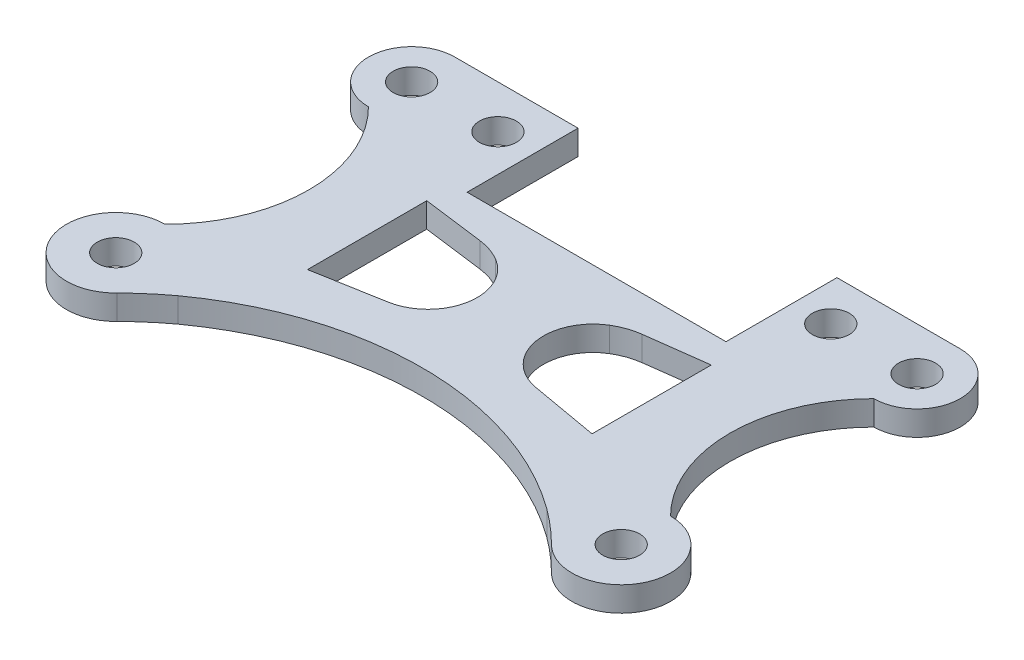
from build123d import *

# Parameters (mm, degrees)
SKETCH1_R             = 1.5
BOSS_EXTRUDE1_DEPTH   = 2
SKETCH2_R             = 3.5
BOSS_EXTRUDE2_DEPTH   = 2
SKETCH3_R             = 1.5
CUT_EXTRUDE1_DEPTH    = 2
SKETCH4_R             = 1.5
CUT_EXTRUDE2_DEPTH    = 2
BOSS_EXTRUDE3_START   = -2
BOSS_EXTRUDE3_DEPTH   = 2
SKETCH8_R             = 4
BOSS_EXTRUDE5_DEPTH   = 2
SKETCH9_R             = 1.5
CUT_EXTRUDE4_DEPTH    = 2
CUT_EXTRUDE5_DEPTH    = 2
BOSS_EXTRUDE12_DEPTH  = 2
CUT_EXTRUDE11_DEPTH   = 2
CUT_EXTRUDE15_DEPTH   = 19
FILLET1_R             = 5
FILLET2_R             = 4
FILLET1_OF_MIRROR13_R = 5
FILLET2_OF_MIRROR13_R = 4


with BuildPart() as part:
    # Sketch1 → Boss-Extrude1 (new body)
    # profile 1 of 5: a face of its own
    with BuildSketch(Plane(origin=(0, 0, 0), x_dir=(1, 0, 0), z_dir=(0, 1, 0))):
        with BuildLine():
            Line((20.5, 14), (10.5, 14))
            Line((10.5, 14), (10.5, 5))
            Line((10.5, 5), (-10.5, 5))
            Line((-10.5, 5), (-10.5, 14))
            Line((-10.5, 14), (-20.5, 14))
            Line((-20.5, 14), (-20.5, -14))
            ThreePointArc((-20.5, -14), (0, -5.789884137), (20.5, -14))
            Line((20.5, -14), (20.5, 7))
            ThreePointArc((20.5, 7), (17, 10.5), (20.5, 14))
        make_face()
        with Locations(Location((13.5, 10.5, 0), (0, 0, 270))):
            Circle(SKETCH1_R, mode=Mode.SUBTRACT)
    # profile 2 of 5: a face of its own
    with BuildSketch(Plane(origin=(0, 0, 0), x_dir=(1, 0, 0), z_dir=(0, 1, 0))):
        with BuildLine():
            ThreePointArc((24, 10.5), (22.974873734, 12.974873734), (20.5, 14))
            Line((20.5, 14), (20.5, 12))
            ThreePointArc((20.5, 12), (21.560660172, 11.560660172), (22, 10.5))
            ThreePointArc((22, 10.5), (21.560660172, 9.439339828), (20.5, 9))
            Line((20.5, 9), (20.5, 7))
            ThreePointArc((20.5, 7), (22.974873734, 8.025126266), (24, 10.5))
        make_face()
    # profile 3 of 5: a face of its own
    with BuildSketch(Plane(origin=(0, 0, 0), x_dir=(1, 0, 0), z_dir=(0, 1, 0))):
        with BuildLine():
            Line((20.5, 12), (20.5, 14))
            ThreePointArc((20.5, 14), (17, 10.5), (20.5, 7))
            Line((20.5, 7), (20.5, 9))
            ThreePointArc((20.5, 9), (19, 10.5), (20.5, 12))
        make_face()
    # profile 4 of 5: a face of its own
    with BuildSketch(Plane(origin=(0, 0, 0), x_dir=(1, 0, 0), z_dir=(0, 1, 0))):
        with BuildLine():
            ThreePointArc((24, 10.5), (22.974873734, 12.974873734), (20.5, 14))
            Line((20.5, 14), (20.5, 12))
            ThreePointArc((20.5, 12), (21.560660172, 11.560660172), (22, 10.5))
            ThreePointArc((22, 10.5), (21.560660172, 9.439339828), (20.5, 9))
            Line((20.5, 9), (20.5, 7))
            ThreePointArc((20.5, 7), (22.974873734, 8.025126266), (24, 10.5))
        make_face()
    # profile 5 of 5: a face of its own
    with BuildSketch(Plane(origin=(0, 0, 0), x_dir=(1, 0, 0), z_dir=(0, 1, 0))):
        with BuildLine():
            Line((20.5, 12), (20.5, 14))
            ThreePointArc((20.5, 14), (17, 10.5), (20.5, 7))
            Line((20.5, 7), (20.5, 9))
            ThreePointArc((20.5, 9), (19, 10.5), (20.5, 12))
        make_face()
    extrude(amount=BOSS_EXTRUDE1_DEPTH)

    # Sketch2 → Boss-Extrude2 (add)
    with BuildSketch(Plane(origin=(0, 2, 0), x_dir=(1, 0, 0), z_dir=(0, 1, 0))):
        with Locations((-20.5, 10.5)):
            Circle(SKETCH2_R)
    extrude(amount=-BOSS_EXTRUDE2_DEPTH)

    # Sketch3 → Cut-Extrude1 (cut)
    with BuildSketch(Plane(origin=(0, 2, 0), x_dir=(1, 0, 0), z_dir=(0, 1, 0))):
        with Locations(Location((-20.5, 10.5, 0), (0, 0, 270))):
            Circle(SKETCH3_R)
    extrude(amount=-CUT_EXTRUDE1_DEPTH, mode=Mode.SUBTRACT)

    # Sketch4 → Cut-Extrude2 (cut)
    with BuildSketch(Plane(origin=(0, 2, 0), x_dir=(1, 0, 0), z_dir=(0, 1, 0))):
        with Locations(Location((-13.5, 10.5, 0), (0, 0, 270))):
            Circle(SKETCH4_R)
    extrude(amount=-CUT_EXTRUDE2_DEPTH, mode=Mode.SUBTRACT)

    # Sketch5 → Boss-Extrude3 (add)
    with BuildSketch(Plane(origin=(0, 2, 0), x_dir=(1, 0, 0), z_dir=(0, 1, 0)).offset(BOSS_EXTRUDE3_START)):
        with BuildLine():
            Line((-20.5, -14), (20.5, -14))
            ThreePointArc((20.5, -14), (0, -5.789884137), (-20.5, -14))
        make_face()
    extrude(amount=BOSS_EXTRUDE3_DEPTH)

    # Sketch8 → Boss-Extrude5 (add)
    with BuildSketch(Plane(origin=(0, 2, 0), x_dir=(1, 0, 0), z_dir=(0, 1, 0))):
        with Locations((20.5, -13.5)):
            Circle(SKETCH8_R)
    boss_extrude5 = extrude(amount=-BOSS_EXTRUDE5_DEPTH)

    # Sketch9 → Cut-Extrude4 (cut)
    with BuildSketch(Plane(origin=(0, 2, 0), x_dir=(1, 0, 0), z_dir=(0, 1, 0))):
        with Locations(Location((20.5, -13.5, 0), (0, 0, 270))):
            Circle(SKETCH9_R)
    cut_extrude4 = extrude(amount=-CUT_EXTRUDE4_DEPTH, mode=Mode.SUBTRACT)

    # Sketch10 → Cut-Extrude5 (cut)
    with BuildSketch(Plane(origin=(0, 2, 0), x_dir=(1, 0, 0), z_dir=(0, 1, 0))):
        with BuildLine():
            Line((20.5, 7), (20.5, -9.5))
            ThreePointArc((20.5, -9.5), (17.08273811, -1.25), (20.5, 7))
        make_face()
    cut_extrude5 = extrude(amount=-CUT_EXTRUDE5_DEPTH, mode=Mode.SUBTRACT)

    # Mirror12: Boss-Extrude5, Cut-Extrude4, Cut-Extrude5 across plane
    add(boss_extrude5.mirror(Plane(origin=(0, 0, 0), x_dir=(0, 0, 1), z_dir=(1, 0, 0))))
    add(cut_extrude4.mirror(Plane(origin=(0, 0, 0), x_dir=(0, 0, 1), z_dir=(1, 0, 0))), mode=Mode.SUBTRACT)
    add(cut_extrude5.mirror(Plane(origin=(0, 0, 0), x_dir=(0, 0, 1), z_dir=(1, 0, 0))), mode=Mode.SUBTRACT)

    # Sketch12 → Boss-Extrude12 (add)
    with BuildSketch(Plane(origin=(0, 2, 0), x_dir=(1, 0, 0), z_dir=(0, 1, 0))):
        with BuildLine():
            Line((-14.965299889, -14), (-16.531373033, -14))
            ThreePointArc((-16.531373033, -14), (-16.889121467, -15.220917262), (-17.61216057, -16.267739768))
            ThreePointArc((-17.61216057, -16.267739768), (-16.328147274, -15.087863095), (-14.965299889, -14))
        make_face()
        with BuildLine():
            Line((16.531373033, -14), (14.965299889, -14))
            ThreePointArc((14.965299889, -14), (16.328147274, -15.087863095), (17.61216057, -16.267739768))
            ThreePointArc((17.61216057, -16.267739768), (16.889121467, -15.220917262), (16.531373033, -14))
        make_face()
    extrude(amount=-BOSS_EXTRUDE12_DEPTH)

    # Sketch20 → Cut-Extrude11 (cut)
    with BuildSketch(Plane(origin=(0, 2, 0), x_dir=(1, 0, 0), z_dir=(0, 1, 0))):
        with BuildLine():
            Line((14.965299889, -14), (-14.965299889, -14))
            ThreePointArc((-14.965299889, -14), (0, -9.149002287), (14.965299889, -14))
        make_face()
    extrude(amount=-CUT_EXTRUDE11_DEPTH, mode=Mode.SUBTRACT)

    # Sketch21 → Cut-Extrude15 (cut)
    with BuildSketch(Plane(origin=(0, 2, 0), x_dir=(1, 0, 0), z_dir=(0, 1, 0))):
        Polygon((11.539683191, 2.764795759), (2.206859121, 1.551865555), (2.206859121, -5.254020589), (11.539683191, -6.904953367), (11.539683191, -2.592312642), align=None)
    cut_extrude15 = extrude(amount=-CUT_EXTRUDE15_DEPTH, mode=Mode.SUBTRACT)

    # Fillet1
    fillet1_edges = [part.edges().sort_by_distance(p)[0] for p in [
        (2.206859121, 1, -1.551865555),
    ]]
    fillet(fillet1_edges, radius=FILLET1_R)

    # Fillet2
    fillet2_edges = [part.edges().sort_by_distance(p)[0] for p in [
        (2.206859121, 1, 5.254020589),
    ]]
    fillet(fillet2_edges, radius=FILLET2_R)

    # Mirror13: Cut-Extrude15 across plane
    add(cut_extrude15.mirror(Plane(origin=(0, 0, 0), x_dir=(0, 0, 1), z_dir=(1, 0, 0))), mode=Mode.SUBTRACT)

    # Fillet1 of Mirror13
    fillet1_of_mirror13_edges = [part.edges().sort_by_distance(p)[0] for p in [
        (-2.206859121, 1, -1.551865555),
    ]]
    fillet(fillet1_of_mirror13_edges, radius=FILLET1_OF_MIRROR13_R)

    # Fillet2 of Mirror13
    fillet2_of_mirror13_edges = [part.edges().sort_by_distance(p)[0] for p in [
        (-2.206859121, 1, 5.254020589),
    ]]
    fillet(fillet2_of_mirror13_edges, radius=FILLET2_OF_MIRROR13_R)


solid = part.part
